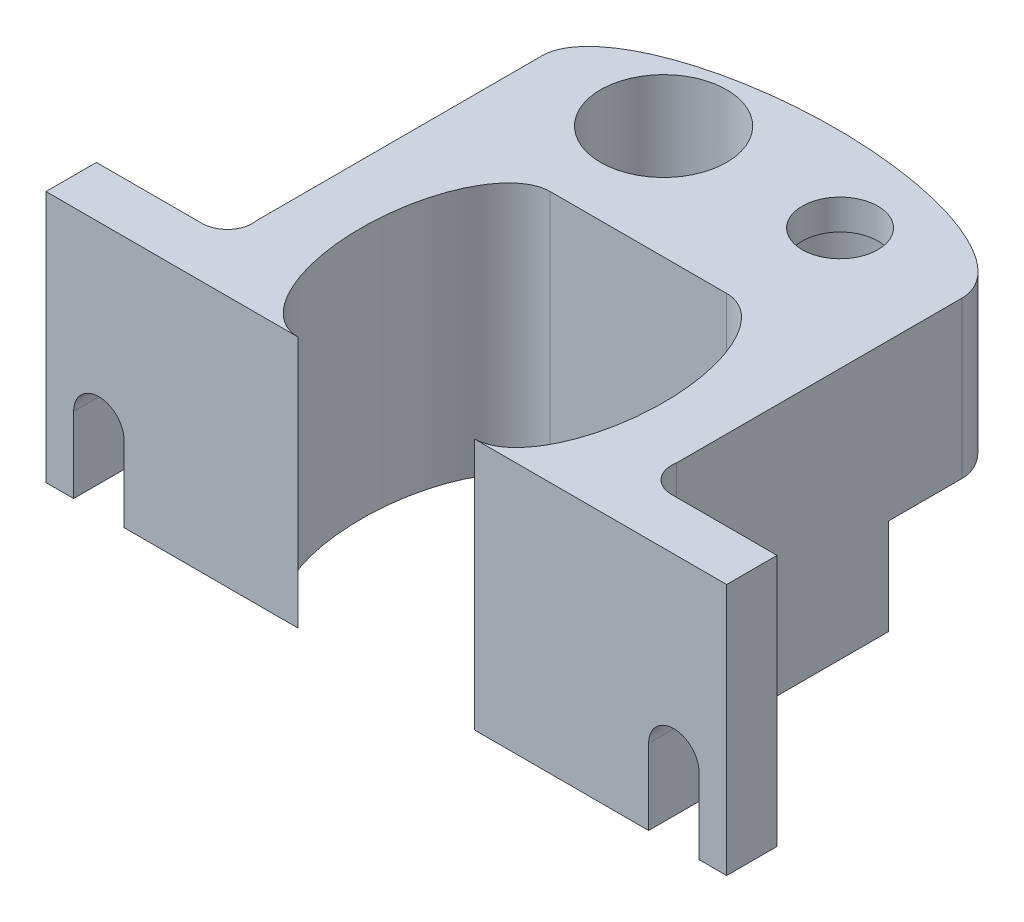
from build123d import *

# Parameters (mm, degrees)
BOSS_EXTRUDE1_DEPTH = 10
CUT_EXTRUDE1_DEPTH  = 10
SKETCH3_R           = 2.5
SKETCH3_R_2         = 1.5
BOSS_EXTRUDE2_DEPTH = 1.2
SKETCH4_R           = 2.5
BOSS_EXTRUDE3_DEPTH = 5


with BuildPart() as part:
    # Sketch1 → Boss-Extrude1 (new body)
    with BuildSketch(Plane(origin=(0, 0, 0), x_dir=(1, 0, 0), z_dir=(0, 1, 0))):
        with BuildLine():
            Line((-3.5, -5), (-13.5, -5))
            Line((-13.5, -5), (-13.5, -3))
            Line((-13.5, -3), (-9.307862042, -3))
            ThreePointArc((-9.307862042, -3), (-8.53716607, -2.637203044), (-8.325682404, -1.812055437))
            Line((-8.325682404, -1.812055437), (-8.325682404, 6.6))
            Line((-8.325682404, 6.6), (8.329091265, 6.6))
            Line((8.329091265, 6.6), (8.329091265, -1.811940526))
            ThreePointArc((8.329091265, -1.811940526), (8.540515661, -2.637157958), (9.311248907, -3))
            Line((9.311248907, -3), (13.5, -3))
            Line((13.5, -3), (13.5, -5))
            Line((13.5, -5), (3.5, -5))
            add(Edge.make_bspline(
                [(3.5, -5), (5.998694825, -5), (5.998694825, 0), (5.998694825, 5), (3.5, 5)],
                knots=[3.141592654, 3.141592654, 3.141592654, 4.71238898, 4.71238898, 6.283185307, 6.283185307, 6.283185307], degree=2, weights=[1, 0.707106781, 1, 0.707106781, 1]))
            Line((3.5, 5), (-3.5, 5))
            add(Edge.make_bspline(
                [(-3.5, 5), (-5.999755012, 5), (-5.999755012, 0), (-5.999755012, -5), (-3.5, -5)],
                knots=[0, 0, 0, 1.570796327, 1.570796327, 3.141592654, 3.141592654, 3.141592654], degree=2, weights=[1, 0.707106781, 1, 0.707106781, 1]))
        make_face()
    extrude(amount=BOSS_EXTRUDE1_DEPTH)

    # Sketch2 → Cut-Extrude1 (cut)
    with BuildSketch(Plane(origin=(0, 0, 3), x_dir=(-1, 0, 0), z_dir=(0, 0, -1))):
        with BuildLine():
            Line((10.403931021, 0), (12.403931021, 0))
            Line((12.403931021, 0), (12.403931021, 3))
            ThreePointArc((12.403931021, 3), (11.403931021, 4), (10.403931021, 3))
            Line((10.403931021, 3), (10.403931021, 0))
        make_face()
        with BuildLine():
            Line((-12.405624454, 0), (-10.405624454, 0))
            Line((-10.405624454, 0), (-10.405624454, 3))
            ThreePointArc((-10.405624454, 3), (-11.405624454, 4), (-12.405624454, 3))
            Line((-12.405624454, 3), (-12.405624454, 0))
        make_face()
    extrude(amount=-CUT_EXTRUDE1_DEPTH, mode=Mode.SUBTRACT)

    # Sketch3 → Boss-Extrude2 (add)
    with BuildSketch(Plane(origin=(0, 10, 0), x_dir=(1, 0, 0), z_dir=(0, 1, 0))):
        with BuildLine():
            Line((-8.325682404, 6.6), (8.329091265, 6.6))
            Line((8.329091265, 6.6), (8.329091265, 9.498637931))
            add(Edge.make_bspline(
                [(8.329091265, 9.498637931), (8.329091265, 12.787490374), (0.119148459, 12.834537728), (-8.090794347, 12.881585081), (-8.325682404, 9.594078672)],
                knots=[0, 0, 0, 1.556490742, 1.556490742, 3.112981484, 3.112981484, 3.112981484], degree=2, weights=[1, 0.712146438, 1, 0.712146438, 1]))
            Line((-8.325682404, 9.594078672), (-8.325682404, 6.6))
        make_face()
        with Locations(Location((-3.5, 9.498637931, 0), (0, 0, 270))):
            Circle(SKETCH3_R, mode=Mode.SUBTRACT)
        with Locations(Location((3.5, 9.498637931, 0), (0, 0, 270))):
            Circle(SKETCH3_R_2, mode=Mode.SUBTRACT)
    extrude(amount=-BOSS_EXTRUDE2_DEPTH)

    # Sketch4 → Boss-Extrude3 (add)
    with BuildSketch(Plane.XZ.offset(-8.8)):
        with BuildLine():
            Line((8.329091265, -6.6), (-8.325682404, -6.6))
            Line((-8.325682404, -6.6), (-8.325682404, -9.40319719))
            Line((-8.325682404, -9.40319719), (-8.325682404, -9.594078672))
            add(Edge.make_bspline(
                [(-8.325682404, -9.594078672), (-8.097422437, -12.78881796), (-0.119148459, -12.834537728), (8.329091265, -12.88295065), (8.329091265, -9.498637931)],
                knots=[3.175928112, 3.175928112, 3.175928112, 4.698083395, 4.698083395, 6.283185307, 6.283185307, 6.283185307], degree=2, weights=[0.977274251, 0.713863718, 1, 0.702030948, 1]))
            Line((8.329091265, -9.498637931), (8.329091265, -6.6))
        make_face()
        with Locations(Location((-3.5, -9.498637931, 0), (0, 0, 90))):
            Circle(SKETCH4_R, mode=Mode.SUBTRACT)
        with Locations(Location((3.5, -9.498637931, 0), (0, 0, 270))):
            Circle(SKETCH4_R, mode=Mode.SUBTRACT)
    extrude(amount=BOSS_EXTRUDE3_DEPTH)


solid = part.part
